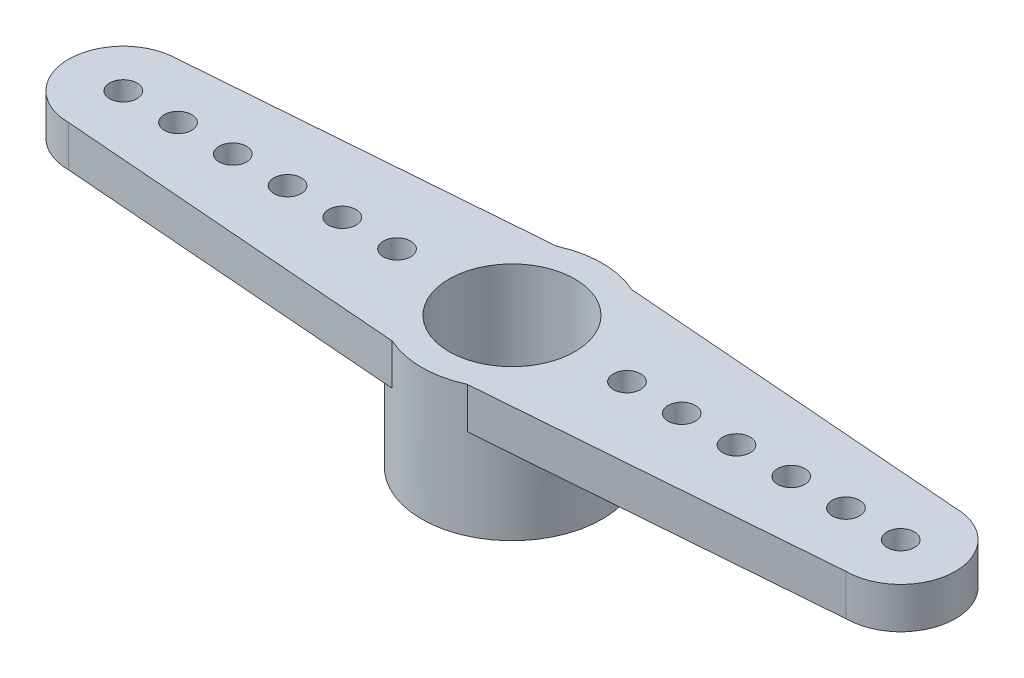
from build123d import *

# Parameters (mm, degrees)
ESBO_O2_R                = 3.3
ESBO_O2_R_2              = 2.3
RESSALTO_EXTRUS_O1_DEPTH = 4.8
RESSALTO_EXTRUS_O2_START = -1.5
ESBO_O3_R                = 0.5
RESSALTO_EXTRUS_O2_DEPTH = 1.5


with BuildPart() as part:
    # Esboço2 → Ressalto-extrusão1 (new body)
    with BuildSketch(Plane(origin=(0, 0, 0), x_dir=(1, 0, 0), z_dir=(0, 1, 0))):
        with Locations(Location((0, 0, 0), (0, 0, 270))):
            Circle(ESBO_O2_R)
        with Locations(Location((0, 0, 0), (0, 0, 270))):
            Circle(ESBO_O2_R_2, mode=Mode.SUBTRACT)
    extrude(amount=RESSALTO_EXTRUS_O1_DEPTH)

    # Esboço3 → Ressalto-extrusão2 (add)
    # profile 1 of 2: a face of its own
    with BuildSketch(Plane(origin=(0, 4.8, 0), x_dir=(1, 0, 0), z_dir=(0, 1, 0)).offset(RESSALTO_EXTRUS_O2_START)):
        with BuildLine():
            Line((14.2, 2), (1.374772708, 3))
            ThreePointArc((1.374772708, 3), (2.777296342, 1.782308904), (3.3, 0))
            ThreePointArc((3.3, 0), (2.777296342, -1.782308904), (1.374772708, -3))
            Line((1.374772708, -3), (14.2, -2))
            ThreePointArc((14.2, -2), (16.2, 0), (14.2, 2))
        make_face()
        with Locations(Location((4.2, 0, 0), (0, 0, 270))):
            Circle(ESBO_O3_R, mode=Mode.SUBTRACT)
        with Locations(Location((6.2, 0, 0), (0, 0, 270))):
            Circle(ESBO_O3_R, mode=Mode.SUBTRACT)
        with Locations(Location((8.2, 0, 0), (0, 0, 270))):
            Circle(ESBO_O3_R, mode=Mode.SUBTRACT)
        with Locations(Location((10.2, 0, 0), (0, 0, 270))):
            Circle(ESBO_O3_R, mode=Mode.SUBTRACT)
        with Locations(Location((12.2, 0, 0), (0, 0, 270))):
            Circle(ESBO_O3_R, mode=Mode.SUBTRACT)
        with Locations(Location((14.2, 0, 0), (0, 0, 270))):
            Circle(ESBO_O3_R, mode=Mode.SUBTRACT)
    # profile 2 of 2: a face of its own
    with BuildSketch(Plane(origin=(0, 4.8, 0), x_dir=(1, 0, 0), z_dir=(0, 1, 0)).offset(RESSALTO_EXTRUS_O2_START)):
        with BuildLine():
            ThreePointArc((-1.374772708, -3), (-3.3, 0), (-1.374772708, 3))
            Line((-1.374772708, 3), (-14.2, 2))
            ThreePointArc((-14.2, 2), (-16.2, 0), (-14.2, -2))
            Line((-14.2, -2), (-1.374772708, -3))
        make_face()
        with Locations(Location((-14.2, 0, 0), (0, 0, 270))):
            Circle(ESBO_O3_R, mode=Mode.SUBTRACT)
        with Locations(Location((-12.2, 0, 0), (0, 0, 270))):
            Circle(ESBO_O3_R, mode=Mode.SUBTRACT)
        with Locations(Location((-10.2, 0, 0), (0, 0, 270))):
            Circle(ESBO_O3_R, mode=Mode.SUBTRACT)
        with Locations(Location((-8.2, 0, 0), (0, 0, 270))):
            Circle(ESBO_O3_R, mode=Mode.SUBTRACT)
        with Locations(Location((-6.2, 0, 0), (0, 0, 270))):
            Circle(ESBO_O3_R, mode=Mode.SUBTRACT)
        with Locations(Location((-4.2, 0, 0), (0, 0, 270))):
            Circle(ESBO_O3_R, mode=Mode.SUBTRACT)
    extrude(amount=RESSALTO_EXTRUS_O2_DEPTH)


solid = part.part
